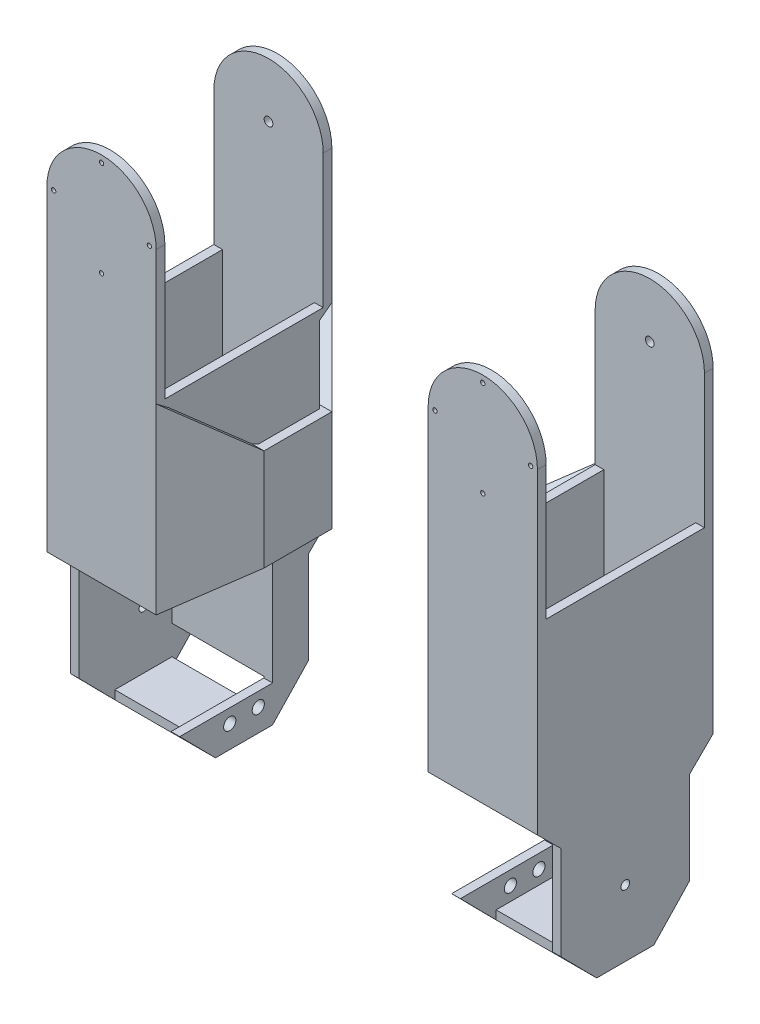
from build123d import *

# Parameters (mm, degrees)
SKETCH_1_W           = 37.7
SKETCH_1_H           = 60.6
SKETCH_1_W_2         = 31.7
SKETCH_1_H_2         = 54.6
EXTRUDE_1_DEPTH      = 60
SKETCH_2_W           = 37.7
SKETCH_2_H           = 3
EXTRUDE_2_DEPTH      = 65
CUT_EXTRUDE_1_DEPTH  = 100
SKETCH_4_W           = 37.7
SKETCH_4_H           = 60.6
EXTRUDE_3_DEPTH      = 3
SKETCH_5_W           = 3
SKETCH_5_H           = 60.6
EXTRUDE_4_DEPTH      = 60.1
SKETCH_7_W           = 5.308475652
SKETCH_7_H           = 1.585967116
CUT_EXTRUDE_2_DEPTH  = 52
SKETCH_9_R           = 2.1
SKETCH_9_W           = 19.7
SKETCH_9_H           = 40.4
CUT_EXTRUDE_4_DEPTH  = 3
SKETCH_10_W          = 31.7
SKETCH_10_H          = 54.6
CUT_EXTRUDE_5_DEPTH  = 3
SKETCH_11_R          = 1.5
CUT_EXTRUDE_6_DEPTH  = 3
EXTRUDE_6_DEPTH      = 63
CUT_EXTRUDE_7_DEPTH  = 18.6
SKETCH_16_R          = 0.75
CUT_EXTRUDE_8_DEPTH  = 3
SKETCH_17_R          = 1.5
CUT_EXTRUDE_9_DEPTH  = 3
SKETCH_21_W          = 20.45
SKETCH_21_H          = 40.4
CUT_EXTRUDE_10_DEPTH = 10
SKETCH_22_W          = 3
SKETCH_22_H          = 39.9
EXTRUDE_7_DEPTH      = 35
CUT_EXTRUDE_11_DEPTH = 39
SKETCH_24_W          = 19.7
SKETCH_24_H          = 3
EXTRUDE_8_DEPTH      = 36


with BuildPart() as part:
    # 草图1 → 凸台-拉伸1 (new body)
    with BuildSketch(Plane(origin=(0, 0, 0), x_dir=(1, 0, 0), z_dir=(0, 1, 0))):
        with Locations((-14.07214144, -10.711520331)):
            Rectangle(SKETCH_1_W, SKETCH_1_H)
        with Locations((-14.07214144, -10.711520331)):
            Rectangle(SKETCH_1_W_2, SKETCH_1_H_2, mode=Mode.SUBTRACT)
    extrude(amount=EXTRUDE_1_DEPTH)

    # 草图2 → 凸台-拉伸2 (add)
    with BuildSketch(Plane(origin=(0, 60, 0), x_dir=(1, 0, 0), z_dir=(0, 1, 0))):
        with Locations((-14.07214144, 18.088479669)):
            Rectangle(SKETCH_2_W, SKETCH_2_H)
        with Locations((-14.07214144, -39.511520331)):
            Rectangle(SKETCH_2_W, SKETCH_2_H)
    extrude(amount=EXTRUDE_2_DEPTH)

    # 草图3 → 切除-拉伸1 (cut)
    with BuildSketch(Plane.XY.offset(41.011520331)):
        with BuildLine():
            Line((4.77785856, 125), (-14.07214144, 125))
            ThreePointArc((-14.07214144, 125), (-0.743178614, 119.478962825), (4.77785856, 106.15))
            Line((4.77785856, 106.15), (4.77785856, 125))
        make_face()
        with BuildLine():
            Line((-32.92214144, 125), (-32.92214144, 106.15))
            ThreePointArc((-32.92214144, 106.15), (-27.401104265, 119.478962825), (-14.07214144, 125))
            Line((-14.07214144, 125), (-32.92214144, 125))
        make_face()
    extrude(amount=-CUT_EXTRUDE_1_DEPTH, mode=Mode.SUBTRACT)

    # 草图4 → 凸台-拉伸3 (add)
    with BuildSketch(Plane.XZ):
        with Locations((-14.07214144, 10.711520331)):
            Rectangle(SKETCH_4_W, SKETCH_4_H)
    extrude(amount=EXTRUDE_3_DEPTH)

    # 草图5 → 凸台-拉伸4 (add)
    with BuildSketch(Plane.XZ.offset(3)):
        with Locations((-31.42214144, 10.711520331)):
            Rectangle(SKETCH_5_W, SKETCH_5_H)
        with Locations((3.27785856, 10.711520331)):
            Rectangle(SKETCH_5_W, SKETCH_5_H)
    extrude(amount=EXTRUDE_4_DEPTH)

    # 草图7 → 切除-拉伸2 (cut)
    with BuildSketch(Plane(origin=(4.77785856, 0, 0), x_dir=(0, 0, -1), z_dir=(1, 0, 0))):
        with Locations((-55.382521172, -90.859075485)):
            Rectangle(SKETCH_7_W, SKETCH_7_H)
        Polygon((-32.894548617, -33.05), (-32.894548617, -11.05), (-41.011520331, -3), (-41.011520331, -63.1), (-32.894548617, -63.1), align=None)
        Polygon((19.588479669, -63.1), (19.588479669, -3), (11.471507955, -11.05), (11.471507955, -33.05), (11.471507955, -63.1), align=None)
    extrude(amount=-CUT_EXTRUDE_2_DEPTH, mode=Mode.SUBTRACT)

    # 草图9 → 切除-拉伸4 (cut)
    with BuildSketch(Plane(origin=(4.77785856, 0, 0), x_dir=(0, 0, -1), z_dir=(1, 0, 0))):
        with Locations((-15.636520331, -48.16)):
            Circle(SKETCH_9_R)
        with Locations((-5.786520331, -48.16)):
            Circle(SKETCH_9_R)
        with Locations(Location((-5.786520331, 1.76, 0), (0, 0, 303.060475305))):
            Circle(SKETCH_9_R)
        with Locations(Location((-15.636520331, 1.76, 0), (0, 0, 303.060475305))):
            Circle(SKETCH_9_R)
        with Locations((-10.711520331, -23.2)):
            Rectangle(SKETCH_9_W, SKETCH_9_H)
    extrude(amount=-CUT_EXTRUDE_4_DEPTH, mode=Mode.SUBTRACT)

    # 草图10 → 切除-拉伸5 (cut)
    with BuildSketch(Plane.XZ.offset(3)):
        with Locations((-14.07214144, 10.711520331)):
            Rectangle(SKETCH_10_W, SKETCH_10_H)
    extrude(amount=-CUT_EXTRUDE_5_DEPTH, mode=Mode.SUBTRACT)

    # 草图11 → 切除-拉伸6 (cut)
    with BuildSketch(Plane.ZY.offset(32.92214144)):
        with Locations((10.711520331, -33.05)):
            Circle(SKETCH_11_R)
    extrude(amount=-CUT_EXTRUDE_6_DEPTH, mode=Mode.SUBTRACT)

    # 草图14 → 凸台-拉伸6 (add)
    with BuildSketch(Plane(origin=(0, 60, 0), x_dir=(1, 0, 0), z_dir=(0, 1, 0))):
        Polygon((23.37785856, 0.988479669), (4.77785856, 19.588479669), (4.77785856, 16.588479669), (4.77785856, 15.345838982), (20.37785856, -0.254161018), (20.37785856, -21.168879644), (4.77785856, -36.768879644), (4.77785856, -38.011520331), (4.77785856, -41.011520331), (23.37785856, -22.411520331), align=None)
    extrude(amount=-EXTRUDE_6_DEPTH)

    # 草图15 → 切除-拉伸7 (cut)
    with BuildSketch(Plane(origin=(23.37785856, 0, 0), x_dir=(0, 0, -1), z_dir=(1, 0, 0))):
        Polygon((-22.411520331, 11), (0.988479669, 11), (19.588479669, -3), (-41.011520331, -3), align=None)
        Polygon((-41.011520331, 60), (19.588479669, 60), (0.988479669, 46), (-22.411520331, 46), align=None)
    extrude(amount=-CUT_EXTRUDE_7_DEPTH, mode=Mode.SUBTRACT)

    # 草图16 → 切除-拉伸8 (cut)
    with BuildSketch(Plane.XY.offset(41.011520331)):
        with Locations((-14.07214144, 122.65)):
            Circle(SKETCH_16_R)
        with Locations((2.42785856, 106.15)):
            Circle(SKETCH_16_R)
        with Locations((-30.57214144, 106.15)):
            Circle(SKETCH_16_R)
        with Locations((-14.07214144, 89.65)):
            Circle(SKETCH_16_R)
    extrude(amount=-CUT_EXTRUDE_8_DEPTH, mode=Mode.SUBTRACT)

    # 草图17 → 切除-拉伸9 (cut)
    with BuildSketch(Plane(origin=(0, 0, -19.588479669), x_dir=(-1, 0, 0), z_dir=(0, 0, -1))):
        with Locations((14.07214144, 106.15)):
            Circle(SKETCH_17_R)
    extrude(amount=-CUT_EXTRUDE_9_DEPTH, mode=Mode.SUBTRACT)


with BuildPart() as body_2:
    # 镜向2: mirrored copy
    add(part.part.mirror(Plane(origin=(51.67785856, 0, 0), x_dir=(0, 0, 1), z_dir=(1, 0, 0))))


with BuildPart() as part_1:
    add(part.part)

    # 草图21 → 切除-拉伸10 (cut)
    with BuildSketch(Plane(origin=(4.77785856, 0, 0), x_dir=(0, 0, -1), z_dir=(1, 0, 0))):
        with Locations((-30.786520331, -23.2)):
            Rectangle(SKETCH_21_W, SKETCH_21_H)
    extrude(amount=-CUT_EXTRUDE_10_DEPTH, mode=Mode.SUBTRACT)

    # 草图22 → 凸台-拉伸7 (add)
    with BuildSketch(Plane(origin=(4.77785856, 0, 0), x_dir=(0, 0, -1), z_dir=(1, 0, 0))):
        with Locations((0.638479669, -22.95)):
            Rectangle(SKETCH_22_W, SKETCH_22_H)
    extrude(amount=-EXTRUDE_7_DEPTH)

    # 草图23 → 切除-拉伸11 (cut)
    with BuildSketch(Plane(origin=(4.77785856, 0, 0), x_dir=(0, 0, -1), z_dir=(1, 0, 0))):
        Polygon((-20.561520331, -55.92), (-32.894548617, -43.4), (-32.894548617, -63.1), (11.471507955, -63.1), (11.471507955, -42.9), (-0.861520331, -55.92), align=None)
    extrude(amount=-CUT_EXTRUDE_11_DEPTH, mode=Mode.SUBTRACT)

    # 草图24 → 凸台-拉伸8 (add)
    with BuildSketch(Plane(origin=(4.77785856, 0, 0), x_dir=(0, 0, -1), z_dir=(1, 0, 0))):
        with Locations((-10.711520331, -54.42)):
            Rectangle(SKETCH_24_W, SKETCH_24_H)
    extrude(amount=-EXTRUDE_8_DEPTH)


with BuildPart() as body_2_2:
    # 镜向6: mirrored copy
    add(part_1.part.mirror(Plane(origin=(51.67785856, 0, 0), x_dir=(0, 0, 1), z_dir=(1, 0, 0))))


solid = Compound([part_1.part, body_2_2.part])
